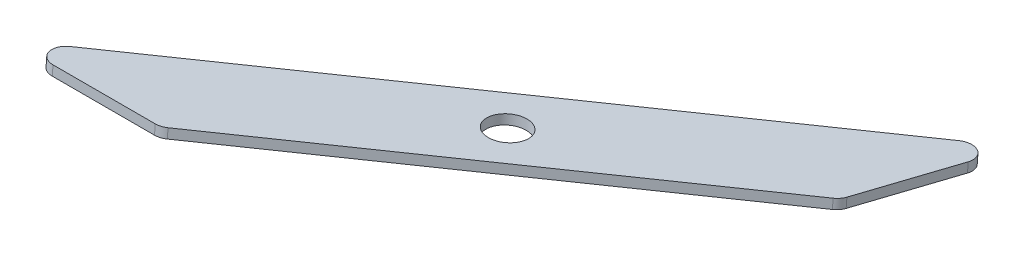
from build123d import *

# Parameters (mm, degrees)
SKETCH1_R           = 3.2639
BOSS_EXTRUDE1_DEPTH = 1.5875
FILLET1_R           = 2.54


with BuildPart() as part:
    # Sketch1 → Boss-Extrude1 (new body)
    with BuildSketch(Plane(origin=(0, 55.360225049, -4.608794225), x_dir=(-1, 0, 0), z_dir=(1.3353901318069464e-14, -0.9965525450230818, 0.08296399826442058))):
        Polygon((-210.818868144, -585.895744737), (-147.350181938, -637.034049567), (-122.047729402, -637.034049567), (-216.201067918, -561.172354397), align=None)
        with Locations((-174.104461851, -605.284049567)):
            Circle(SKETCH1_R, mode=Mode.SUBTRACT)
    extrude(amount=BOSS_EXTRUDE1_DEPTH)

    # Fillet1
    fillet1_edges = [part.edges().sort_by_distance(p)[0] for p in [
        (122.047729402, 107.420103249, 630.294961811),
        (147.350181938, 107.420103249, 630.294961811),
        (210.818868144, 103.177465016, 579.332953984),
        (216.201067918, 101.126313702, 554.694796419),
    ]]
    fillet(fillet1_edges, radius=FILLET1_R)


solid = part.part
